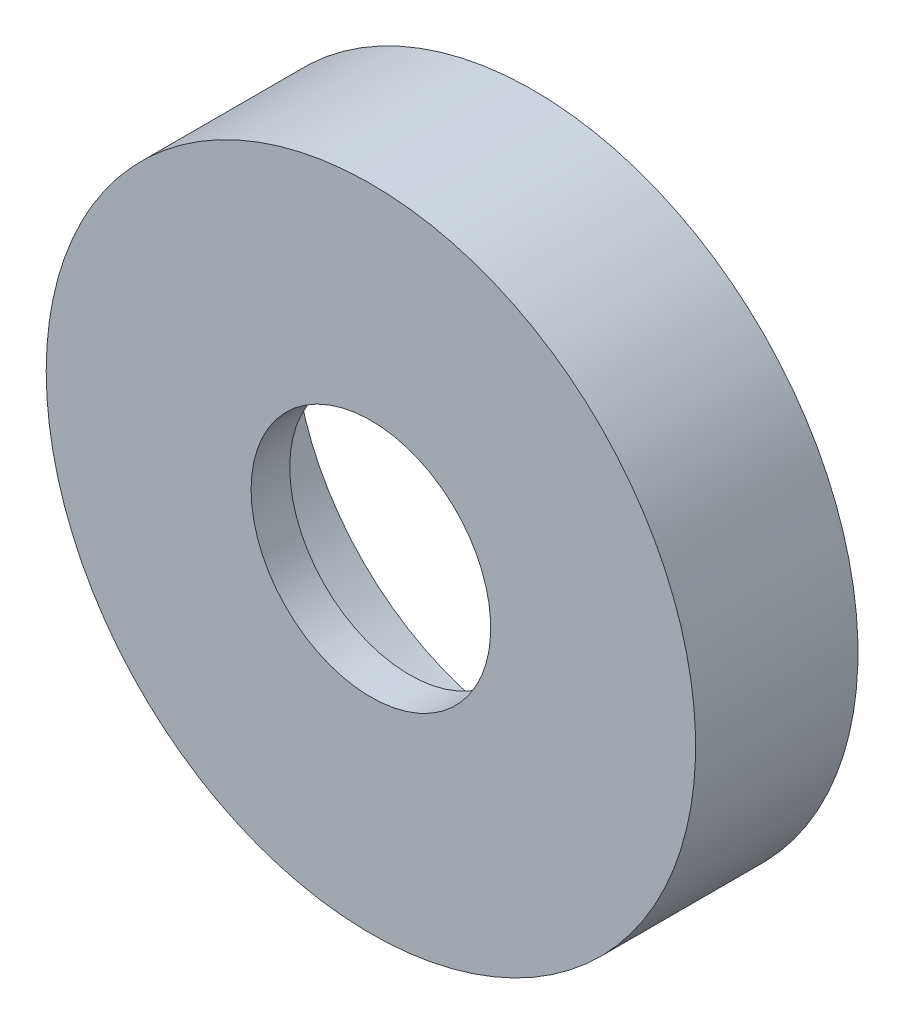
from build123d import *

# Parameters (mm, degrees)
SKETCH_1_R          = 42
EXTRUDE_1_DEPTH     = 21
SKETCH_2_R          = 31
CUT_EXTRUDE_2_DEPTH = 16
SKETCH_3_R          = 15.5
CUT_EXTRUDE_3_DEPTH = 62.514225997


with BuildPart() as part:
    # Эскиз1 → Вытянуть1 (new body)
    with BuildSketch(Plane.XY):
        with Locations(Location((0, 0, 0), (0, 0, 180))):
            Circle(SKETCH_1_R)
    extrude(amount=EXTRUDE_1_DEPTH)

    # Эскиз2 → Вытянуть2 (cut)
    with BuildSketch(Plane(origin=(0, 0, 0), x_dir=(-1, 0, 0), z_dir=(0, 0, -1))):
        Circle(SKETCH_2_R)
    extrude(amount=-CUT_EXTRUDE_2_DEPTH, mode=Mode.SUBTRACT)

    # Эскиз3 → Вытянуть3 (cut, through all)
    with BuildSketch(Plane(origin=(0, 0, 16), x_dir=(-1, 0, 0), z_dir=(0, 0, -1))):
        Circle(SKETCH_3_R)
    extrude(amount=-CUT_EXTRUDE_3_DEPTH, mode=Mode.SUBTRACT)


solid = part.part
